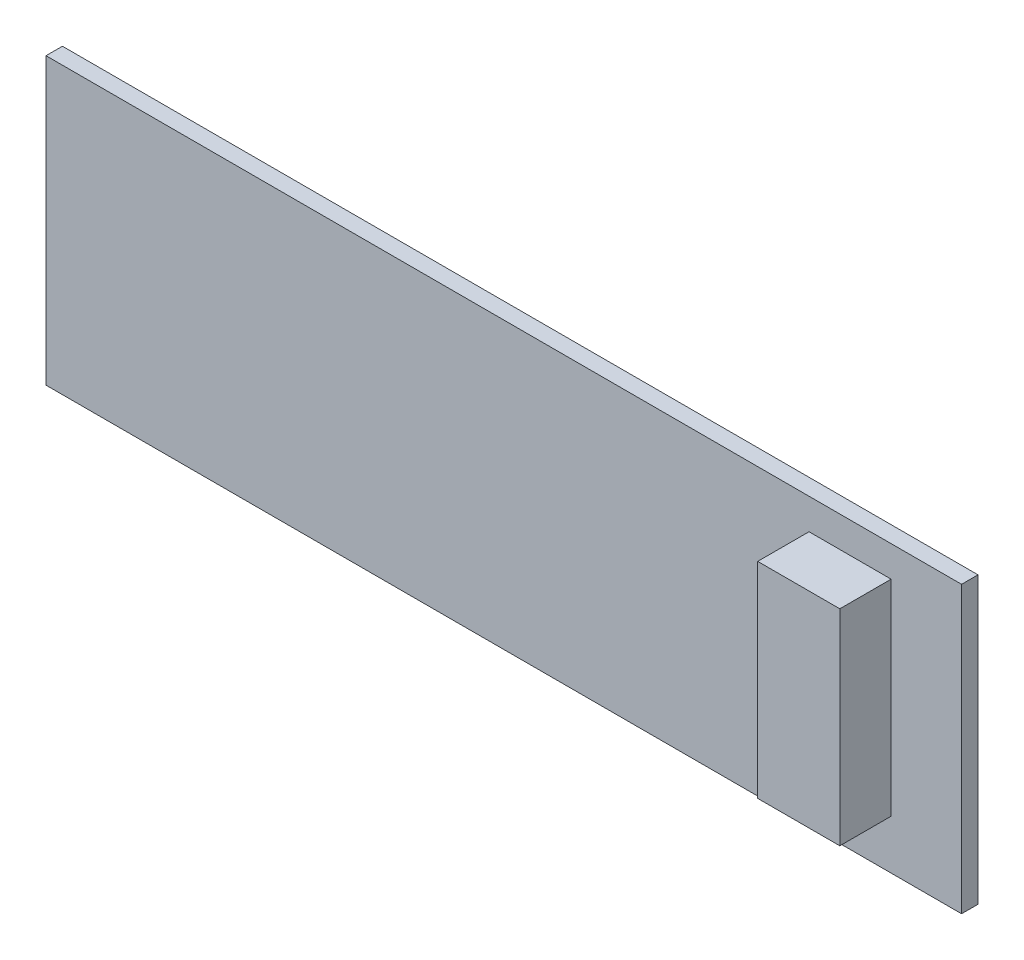
from build123d import *

# Parameters (mm, degrees)
SKETCH1_W           = 89.2
SKETCH1_H           = 27.8
BOSS_EXTRUDE1_DEPTH = 1.6
SKETCH2_W           = 8
SKETCH2_H           = 20
BOSS_EXTRUDE2_DEPTH = 5


with BuildPart() as part:
    # Sketch1 → Boss-Extrude1 (new body)
    with BuildSketch(Plane.XY):
        Rectangle(SKETCH1_W, SKETCH1_H)
    extrude(amount=-BOSS_EXTRUDE1_DEPTH)

    # Sketch2 → Boss-Extrude2 (add)
    with BuildSketch(Plane.XY):
        with Locations((33.737615696, 0.903158009)):
            Rectangle(SKETCH2_W, SKETCH2_H)
    extrude(amount=BOSS_EXTRUDE2_DEPTH)


solid = part.part
